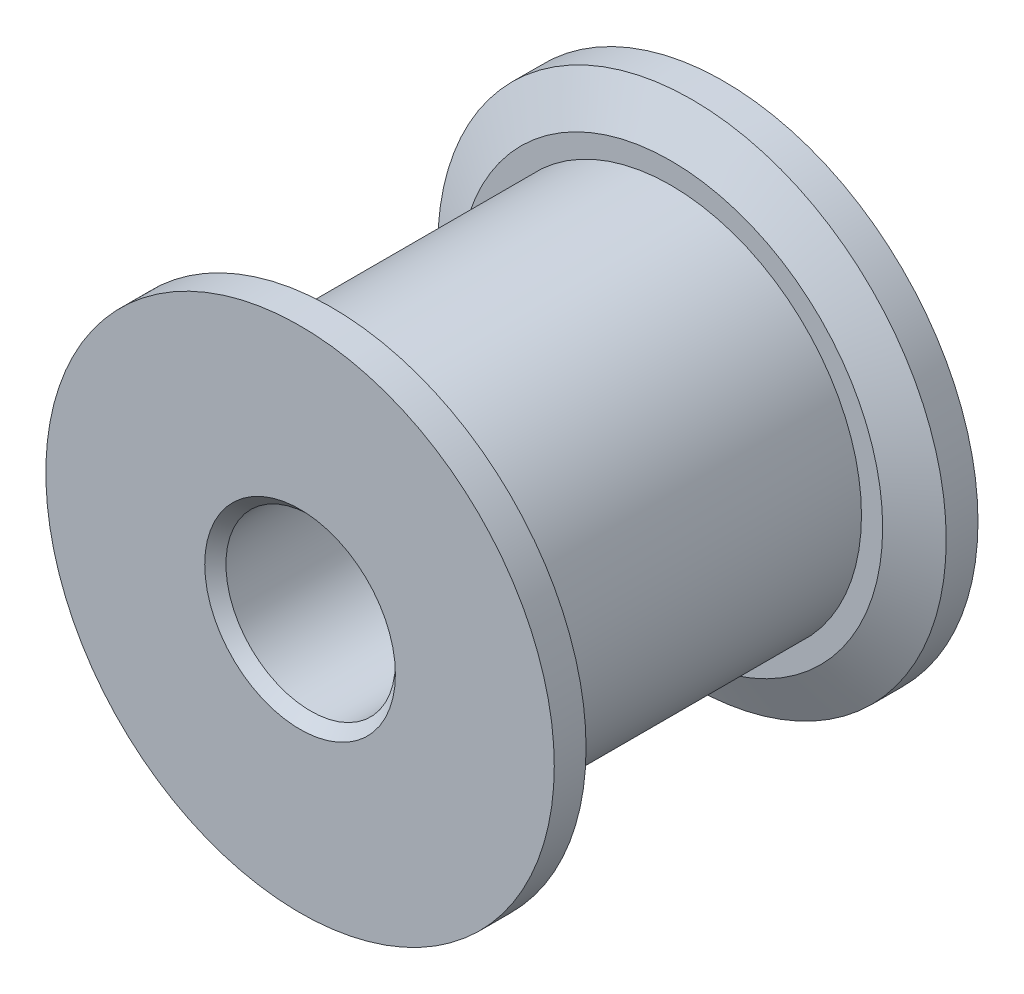
from build123d import *

# Parameters (mm, degrees)
SKETCH1_R                 = 18
EXTRUDE1_DEPTH            = 15
SKETCH2_R                 = 24
EXTRUDE2_DEPTH            = 5
CHAMFER2_SIZE             = 4
CHAMFER2_SIZE2            = 2
CHAMFER2_OF_MIRROR2_SIZE2 = 4
CHAMFER2_OF_MIRROR2_SIZE  = 2
EXTRUDE3_DEPTH            = 40.395431207
EXTRUDE3_DEPTH_BACK       = 40.395431207
SKETCH3_R                 = 8
CHAMFER3_SIZE             = 1


with BuildPart() as part:
    # Sketch1 → Extrude1 (new, symmetric)
    with BuildSketch(Plane.XY):
        Circle(SKETCH1_R)
    extrude(amount=EXTRUDE1_DEPTH, both=True)

    # Sketch2 → Extrude2 (add)
    with BuildSketch(Plane.XY.offset(15)):
        Circle(SKETCH2_R)
    extrude2 = extrude(amount=EXTRUDE2_DEPTH)

    # Chamfer2
    chamfer2_edges = [part.edges().sort_by_distance(p)[0] for p in [
        (-24, 0, 15),
    ]]
    chamfer2_side = [part.faces().sort_by_distance(p)[0] for p in [
        (-23.32117749, 0, 15),
    ]]
    chamfer(chamfer2_edges, length=CHAMFER2_SIZE, length2=CHAMFER2_SIZE2, reference=chamfer2_side[0])

    # Mirror2: Extrude2 across plane
    add(extrude2.mirror(Plane.XY))

    # Chamfer2 of Mirror2
    chamfer2_of_mirror2_edges = [part.edges().sort_by_distance(p)[0] for p in [
        (-24, 0, -15),
    ]]
    chamfer(chamfer2_of_mirror2_edges, length=CHAMFER2_OF_MIRROR2_SIZE, length2=CHAMFER2_OF_MIRROR2_SIZE2)

    # Sketch3 → Extrude3 (cut, two sides: drawn at the far end of the back side and taken through both)
    with BuildSketch(Plane.XY.offset(-EXTRUDE3_DEPTH_BACK)):
        Circle(SKETCH3_R)
    extrude(amount=EXTRUDE3_DEPTH + EXTRUDE3_DEPTH_BACK, mode=Mode.SUBTRACT)

    # Chamfer3
    chamfer3_edges = [part.edges().sort_by_distance(p)[0] for p in [
        (-8, 0, -20),
        (-8, 0, 20),
    ]]
    chamfer(chamfer3_edges, length=CHAMFER3_SIZE)


solid = part.part
